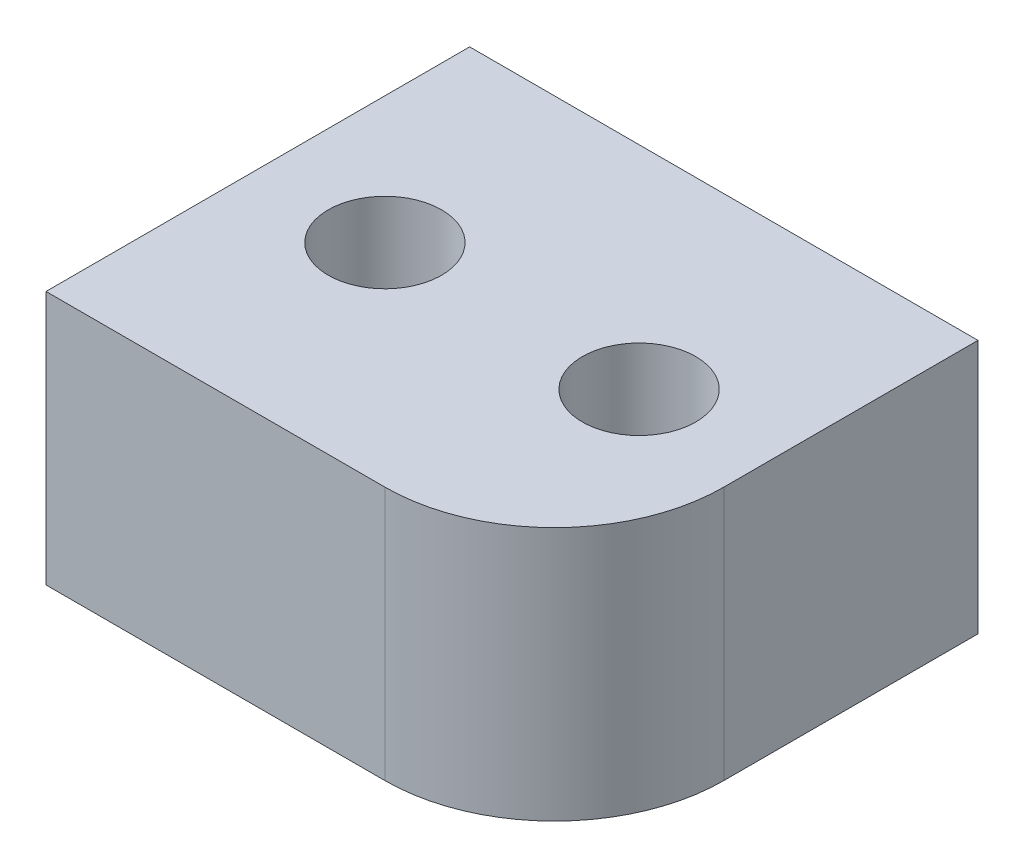
from build123d import *

# Parameters (mm, degrees)
SKETCH1_W           = 15.24
SKETCH1_H           = 12.7
SKETCH1_R           = 1.7
BOSS_EXTRUDE1_DEPTH = 7.62
FILLET1_R           = 5.08


with BuildPart() as part:
    # Sketch1 → Boss-Extrude1 (new body)
    with BuildSketch(Plane(origin=(0, 0, 0), x_dir=(1, 0, 0), z_dir=(0, 1, 0))):
        with Locations((7.62, 6.35)):
            Rectangle(SKETCH1_W, SKETCH1_H)
        with Locations(Location((11.43, 6.35, 0), (0, 0, 90))):
            Circle(SKETCH1_R, mode=Mode.SUBTRACT)
        with Locations(Location((3.81, 6.35, 0), (0, 0, 90))):
            Circle(SKETCH1_R, mode=Mode.SUBTRACT)
    extrude(amount=BOSS_EXTRUDE1_DEPTH)

    # Fillet1
    fillet1_edges = [part.edges().sort_by_distance(p)[0] for p in [
        (15.24, 3.81, 0),
    ]]
    fillet(fillet1_edges, radius=FILLET1_R)


solid = part.part
